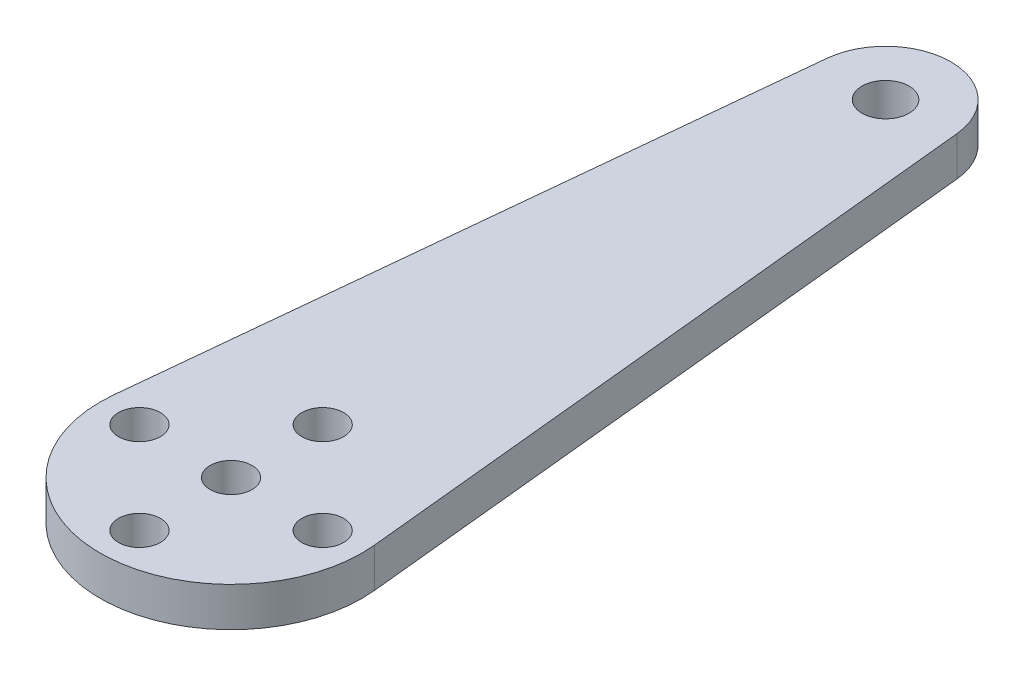
from build123d import *

# Parameters (mm, degrees)
SKETCH_1_R      = 5
SKETCH_1_R_2    = 1.8
SKETCH_1_R_3    = 10
SKETCH_1_R_4    = 1.6
EXTRUDE_1_DEPTH = 3


with BuildPart() as part:
    # 草图1 → 凸台-拉伸1 (new body)
    # profile 1 of 3: a face of its own
    with BuildSketch(Plane(origin=(0, 0, 0), x_dir=(1, 0, 0), z_dir=(0, 1, 0))):
        with Locations((0, 50)):
            Circle(SKETCH_1_R)
        with Locations(Location((0, 50, 0), (0, 0, 270))):
            Circle(SKETCH_1_R_2, mode=Mode.SUBTRACT)
    # profile 2 of 3: a face of its own
    with BuildSketch(Plane(origin=(0, 0, 0), x_dir=(1, 0, 0), z_dir=(0, 1, 0))):
        with BuildLine():
            ThreePointArc((5, 50), (-0.250313875, 45.006269634), (-4.974937186, 50.5))
            Line((-4.974937186, 50.5), (-9.949874371, 1))
            ThreePointArc((-9.949874371, 1), (0, 10), (9.949874371, 1))
            Line((9.949874371, 1), (4.974937186, 50.5))
            ThreePointArc((4.974937186, 50.5), (4.993730366, 50.250313875), (5, 50))
        make_face()
    # profile 3 of 3: a face of its own
    with BuildSketch(Plane(origin=(0, 0, 0), x_dir=(1, 0, 0), z_dir=(0, 1, 0))):
        Circle(SKETCH_1_R_3)
        with Locations(Location((7, 0, 0), (0, 0, 270))):
            Circle(SKETCH_1_R_4, mode=Mode.SUBTRACT)
        with Locations(Location((0, 7, 0), (0, 0, 270))):
            Circle(SKETCH_1_R_4, mode=Mode.SUBTRACT)
        with Locations(Location((0, 0, 0), (0, 0, 270))):
            Circle(SKETCH_1_R_4, mode=Mode.SUBTRACT)
        with Locations(Location((0, -7, 0), (0, 0, 270))):
            Circle(SKETCH_1_R_4, mode=Mode.SUBTRACT)
        with Locations(Location((-7, 0, 0), (0, 0, 270))):
            Circle(SKETCH_1_R_4, mode=Mode.SUBTRACT)
    extrude(amount=EXTRUDE_1_DEPTH)


solid = part.part
